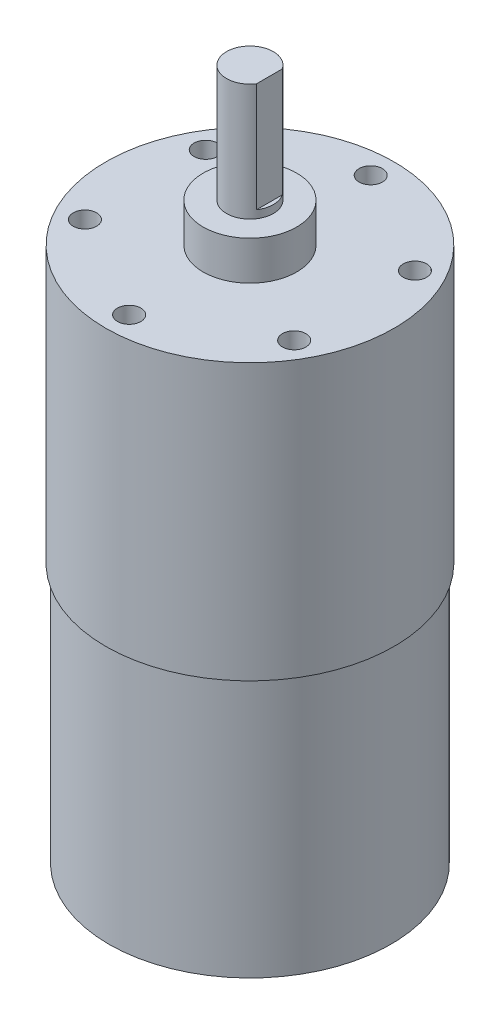
from build123d import *

# Parameters (mm, degrees)
SKETCH1_R               = 18.1
BOSS_EXTRUDE1_DEPTH     = 33.3
SKETCH2_R               = 18.5
BOSS_EXTRUDE2_DEPTH     = 35.3568
SKETCH3_R               = 6
BOSS_EXTRUDE3_DEPTH     = 5
SKETCH4_R               = 3
BOSS_EXTRUDE4_DEPTH     = 15
CUT_EXTRUDE1_DEPTH      = 93.436617129
CUT_EXTRUDE1_DEPTH_BACK = 93.436617129
SKETCH5_W               = 0.5
SKETCH5_H               = 14
SKETCH6_R               = 1.5
CUT_EXTRUDE2_DEPTH      = 10
CIRPATTERN1_COUNT       = 6


with BuildPart() as part:
    # Sketch1 → Boss-Extrude1 (new body)
    with BuildSketch(Plane(origin=(0, 0, 0), x_dir=(1, 0, 0), z_dir=(0, 1, 0))):
        with Locations(Location((0, 0, 0), (0, 0, 270))):
            Circle(SKETCH1_R)
    extrude(amount=BOSS_EXTRUDE1_DEPTH)

    # Sketch2 → Boss-Extrude2 (add)
    with BuildSketch(Plane(origin=(0, 33.3, 0), x_dir=(1, 0, 0), z_dir=(0, 1, 0))):
        with Locations(Location((0, 0, 0), (0, 0, 270))):
            Circle(SKETCH2_R)
    extrude(amount=BOSS_EXTRUDE2_DEPTH)

    # Sketch3 → Boss-Extrude3 (add)
    with BuildSketch(Plane(origin=(0, 68.6568, 0), x_dir=(1, 0, 0), z_dir=(0, 1, 0))):
        with Locations(Location((0, 0, 0), (0, 0, 270))):
            Circle(SKETCH3_R)
    extrude(amount=BOSS_EXTRUDE3_DEPTH)

    # Sketch4 → Boss-Extrude4 (add)
    with BuildSketch(Plane(origin=(0, 73.6568, 0), x_dir=(1, 0, 0), z_dir=(0, 1, 0))):
        with Locations(Location((0, 0, 0), (0, 0, 270))):
            Circle(SKETCH4_R)
    extrude(amount=BOSS_EXTRUDE4_DEPTH)

    # Sketch5 → Cut-Extrude1 (cut, two sides: drawn at the far end of the back side and taken through both)
    with BuildSketch(Plane.XY.offset(-CUT_EXTRUDE1_DEPTH_BACK)):
        with Locations((2.75, 81.6568)):
            Rectangle(SKETCH5_W, SKETCH5_H)
    extrude(amount=CUT_EXTRUDE1_DEPTH + CUT_EXTRUDE1_DEPTH_BACK, mode=Mode.SUBTRACT)

    # Sketch6 → Cut-Extrude2 (cut)
    with BuildSketch(Plane(origin=(0, 68.6568, 0), x_dir=(1, 0, 0), z_dir=(0, 1, 0))):
        with Locations(Location((0, 15.5, 0), (0, 0, 270))):
            Circle(SKETCH6_R)
    cut_extrude2 = extrude(amount=-CUT_EXTRUDE2_DEPTH, mode=Mode.SUBTRACT)

    # CirPattern1: Cut-Extrude2 ×6 about axis
    cirpattern1_axis = Axis((0, 0, 0), (0, 1, 0))
    for i in range(1, CIRPATTERN1_COUNT):
        add(cut_extrude2.rotate(cirpattern1_axis, i * 360 / CIRPATTERN1_COUNT), mode=Mode.SUBTRACT)


solid = part.part
